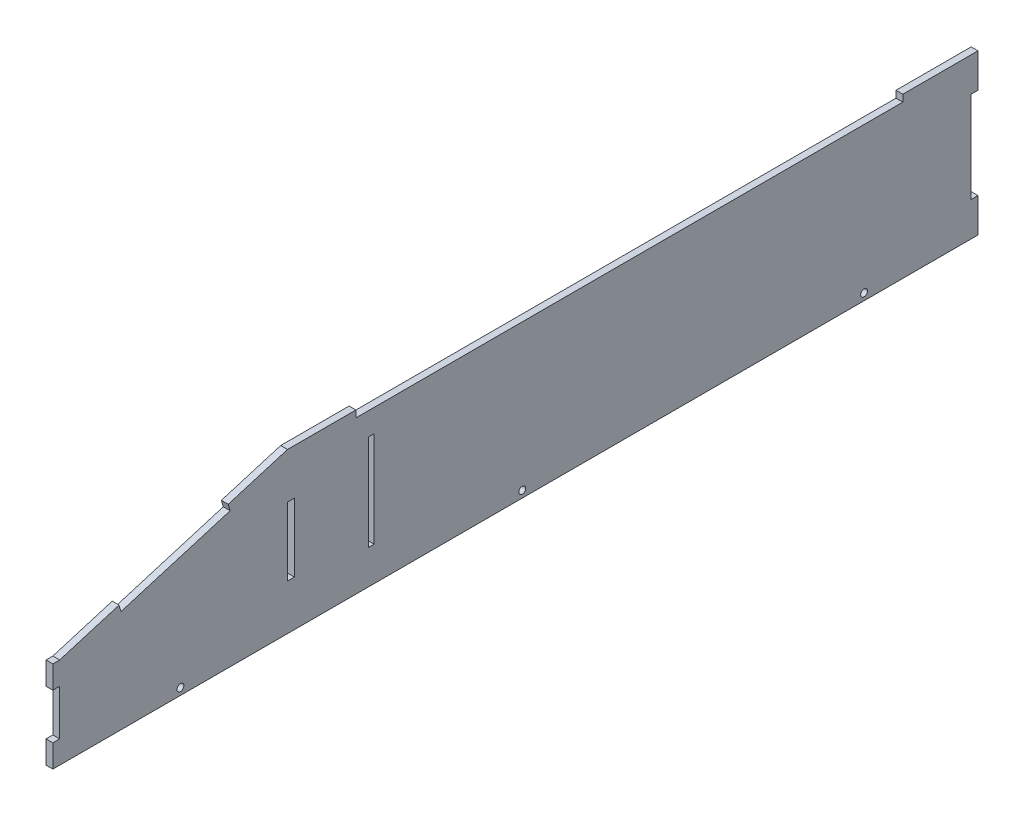
from build123d import *

# Parameters (mm, degrees)
BOSS_EXTRUDE1_DEPTH      = 3
CUT_EXTRUDE2_DEPTH       = 295.638673234
CUT_EXTRUDE2_DEPTH_BACK  = 3
CUT_EXTRUDE6_DEPTH       = 295.638673234
CUT_EXTRUDE6_DEPTH_BACK  = 3
CUT_EXTRUDE11_DEPTH      = 295.638673234
CUT_EXTRUDE11_DEPTH_BACK = 3
CUT_EXTRUDE12_DEPTH      = 295.638673234
CUT_EXTRUDE12_DEPTH_BACK = 3
SKETCH9_W                = 3
SKETCH9_H                = 30
CUT_EXTRUDE13_DEPTH      = 3
SKETCH10_W               = 2.5
SKETCH10_H               = 42
CUT_EXTRUDE14_DEPTH      = 10
SKETCH11_R               = 1.5
CUT_EXTRUDE15_DEPTH      = 10


with BuildPart() as part:
    # Sketch1 → Boss-Extrude1 (new body)
    with BuildSketch(Plane(origin=(0, 0, 0), x_dir=(0, 0, -1), z_dir=(1, 0, 0))):
        Polygon((286.144320394, 0.17389594), (286.144320394, 70.17389594), (-16.855679606, 70.17389594), (-116.855679606, 40.17389594), (-119.855679606, 40.17389594), (-119.855679606, 0.17389594), align=None)
    extrude(amount=BOSS_EXTRUDE1_DEPTH)

    # Sketch5 → Cut-Extrude2 (cut, two sides: drawn at the far end of the back side and taken through both)
    with BuildSketch(Plane(origin=(3, 0, 0), x_dir=(0, 0, -1), z_dir=(1, 0, 0)).offset(-CUT_EXTRUDE2_DEPTH_BACK)):
        Polygon((1115.56118622, 55.17389594), (286.144320394, 55.17389594), (283.144320394, 55.17389594), (283.144320394, 15.17389594), (286.144320394, 15.17389594), (1115.56118622, 15.17389594), (2774.394917872, 15.17389594), (2774.394917872, 55.17389594), align=None)
    extrude(amount=CUT_EXTRUDE2_DEPTH + CUT_EXTRUDE2_DEPTH_BACK, mode=Mode.SUBTRACT)

    # Sketch6 → Cut-Extrude6 (cut, two sides: drawn at the far end of the back side and taken through both)
    with BuildSketch(Plane(origin=(3, 0, 0), x_dir=(0, 0, -1), z_dir=(1, 0, 0)).offset(-CUT_EXTRUDE6_DEPTH_BACK)):
        Polygon((253.144320394, 839.196952243), (253.144320394, 70.17389594), (253.144320394, 67.17389594), (13.144320394, 67.17389594), (13.144320394, 70.17389594), (13.144320394, 839.196952243), (13.144320394, 2377.24306485), (253.144320394, 2377.24306485), align=None)
    extrude(amount=CUT_EXTRUDE6_DEPTH + CUT_EXTRUDE6_DEPTH_BACK, mode=Mode.SUBTRACT)

    # Sketch7 → Cut-Extrude11 (cut, two sides: drawn at the far end of the back side and taken through both)
    with BuildSketch(Plane(origin=(3, 0, 0), x_dir=(0, 0, -1), z_dir=(1, 0, 0)).offset(-CUT_EXTRUDE11_DEPTH_BACK)):
        Polygon((-264.146282978, 799.817128167), (-42.908554564, 62.358033452), (-42.046510907, 59.484554597), (-89.937825168, 45.117160318), (-90.799868825, 47.990639174), (-312.037597239, 785.449733889), (-754.513054068, 2260.367923318), (-706.621739807, 2274.735317597), align=None)
    extrude(amount=CUT_EXTRUDE11_DEPTH + CUT_EXTRUDE11_DEPTH_BACK, mode=Mode.SUBTRACT)

    # Sketch8 → Cut-Extrude12 (cut, two sides: drawn at the far end of the back side and taken through both)
    with BuildSketch(Plane(origin=(3, 0, 0), x_dir=(0, 0, -1), z_dir=(1, 0, 0)).offset(-CUT_EXTRUDE12_DEPTH_BACK)):
        Polygon((-950.674782697, 30.17389594), (-119.855679606, 30.17389594), (-116.855679606, 30.17389594), (-116.855679606, 10.17389594), (-119.855679606, 10.17389594), (-950.674782697, 10.17389594), (-2612.31298888, 10.17389594), (-2612.31298888, 30.17389594), align=None)
    extrude(amount=CUT_EXTRUDE12_DEPTH + CUT_EXTRUDE12_DEPTH_BACK, mode=Mode.SUBTRACT)

    # Sketch9 → Cut-Extrude13 (cut)
    with BuildSketch(Plane(origin=(3, 0, 0), x_dir=(0, 0, -1), z_dir=(1, 0, 0))):
        with Locations((-15.355679606, 35.17389594)):
            Rectangle(SKETCH9_W, SKETCH9_H)
    extrude(amount=-CUT_EXTRUDE13_DEPTH, mode=Mode.SUBTRACT)

    # Sketch10 → Cut-Extrude14 (cut)
    with BuildSketch(Plane(origin=(3, 0, 0), x_dir=(0, 0, -1), z_dir=(1, 0, 0))):
        with Locations((19.894320394, 36.17389594)):
            Rectangle(SKETCH10_W, SKETCH10_H)
    extrude(amount=-CUT_EXTRUDE14_DEPTH, mode=Mode.SUBTRACT)

    # Sketch11 → Cut-Extrude15 (cut)
    with BuildSketch(Plane(origin=(3, 0, 0), x_dir=(0, 0, -1), z_dir=(1, 0, 0))):
        with Locations((236.144320394, 3.17389594)):
            Circle(SKETCH11_R)
        with Locations((86.144320394, 3.17389594)):
            Circle(SKETCH11_R)
        with Locations((-63.855679606, 3.17389594)):
            Circle(SKETCH11_R)
    extrude(amount=-CUT_EXTRUDE15_DEPTH, mode=Mode.SUBTRACT)


solid = part.part
